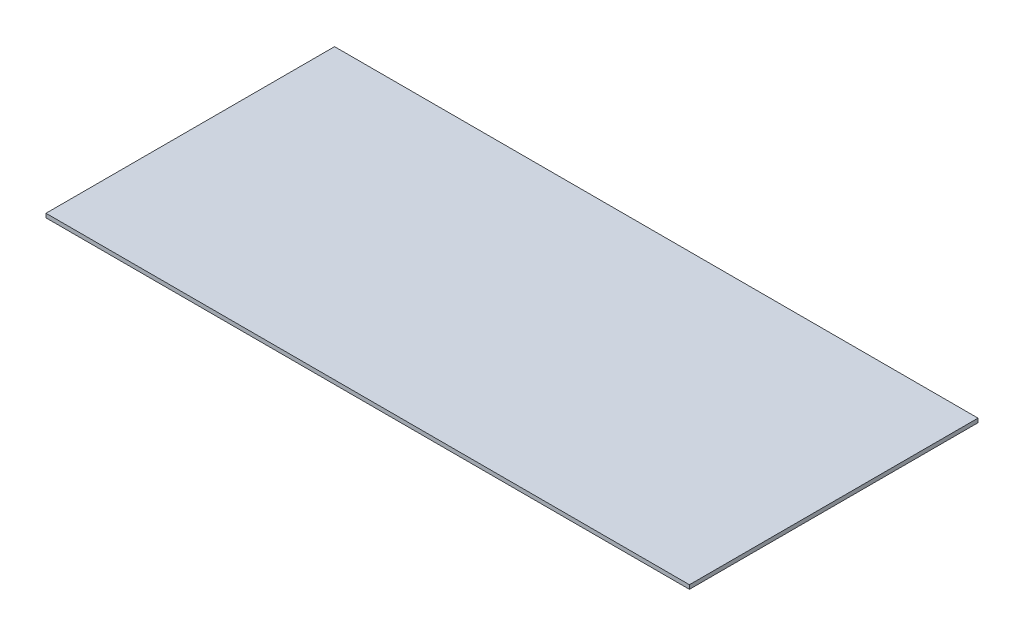
from build123d import *

# Parameters (mm, degrees)
SKETCH1_W           = 508
SKETCH1_H           = 227.838
BOSS_EXTRUDE1_DEPTH = 3.175


with BuildPart() as part:
    # Sketch1 → Boss-Extrude1 (new body)
    with BuildSketch(Plane(origin=(0, 0, 0), x_dir=(1, 0, 0), z_dir=(0, 1, 0))):
        with Locations((254, 113.919)):
            Rectangle(SKETCH1_W, SKETCH1_H)
    extrude(amount=BOSS_EXTRUDE1_DEPTH)


solid = part.part
